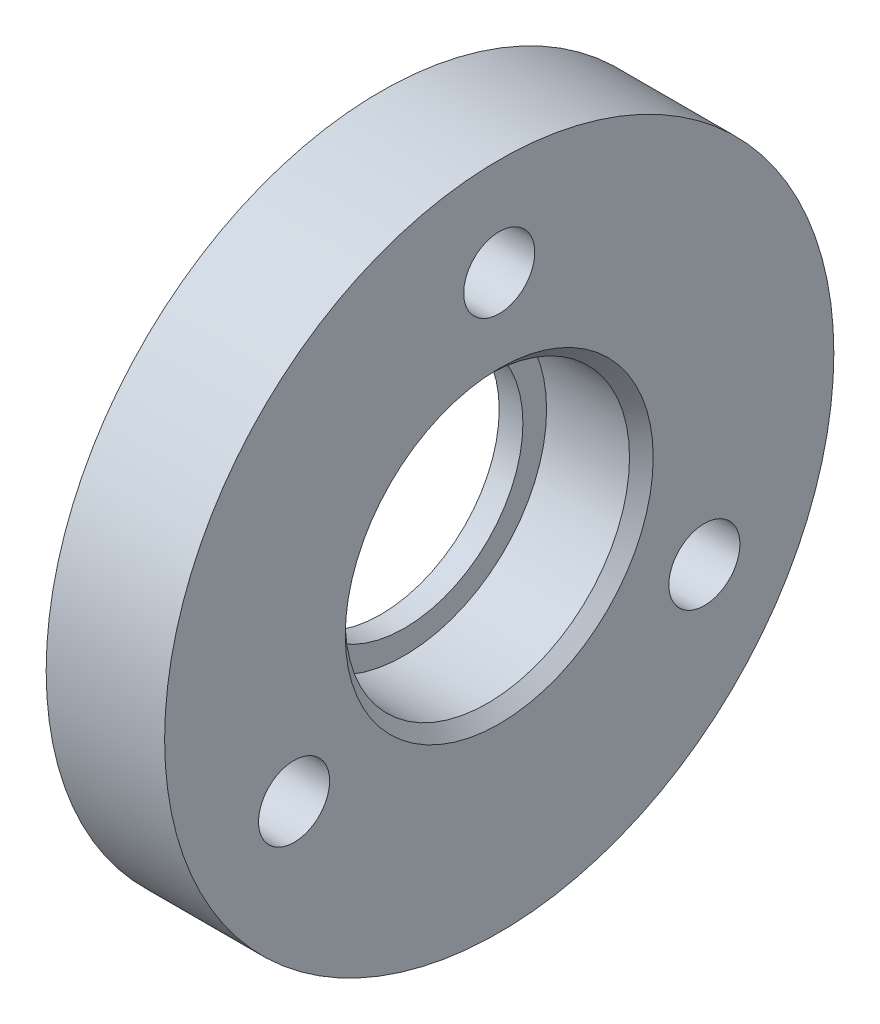
from build123d import *

# Parameters (mm, degrees)
SKETCH3_R           = 14.125
SKETCH3_R_2         = 6
BOSS_EXTRUDE1_DEPTH = 5
BOSS_EXTRUDE2_START = -5
SKETCH4_R           = 6
SKETCH4_R_2         = 5
BOSS_EXTRUDE2_DEPTH = 1
SKETCH5_R           = 1.5
CUT_EXTRUDE1_DEPTH  = 10
CHAMFER1_SIZE       = 0.5


with BuildPart() as part:
    # Sketch3 → Boss-Extrude1 (new body)
    with BuildSketch(Plane.YZ):
        with Locations(Location((0, 0, 0), (0, 0, 270))):
            Circle(SKETCH3_R)
        with Locations(Location((0, 0, 0), (0, 0, 270))):
            Circle(SKETCH3_R_2, mode=Mode.SUBTRACT)
    extrude(amount=BOSS_EXTRUDE1_DEPTH)

    # Sketch4 → Boss-Extrude2 (add)
    with BuildSketch(Plane.YZ.offset(5).offset(BOSS_EXTRUDE2_START)):
        with Locations(Location((0, 0, 0), (0, 0, 270))):
            Circle(SKETCH4_R)
        with Locations(Location((0, 0, 0), (0, 0, 270))):
            Circle(SKETCH4_R_2, mode=Mode.SUBTRACT)
    extrude(amount=BOSS_EXTRUDE2_DEPTH)

    # Sketch5 → Cut-Extrude1 (cut)
    with BuildSketch(Plane(origin=(5, 0, 0), x_dir=(0, 0, -1), z_dir=(1, 0, 0))):
        with Locations((0, 10)):
            Circle(SKETCH5_R)
        with Locations((8.660254038, -5)):
            Circle(SKETCH5_R)
        with Locations((-8.660254038, -5)):
            Circle(SKETCH5_R)
    extrude(amount=-CUT_EXTRUDE1_DEPTH, mode=Mode.SUBTRACT)

    # Chamfer1
    chamfer1_edges = [part.edges().sort_by_distance(p)[0] for p in [
        (5, 0, 6),
    ]]
    chamfer(chamfer1_edges, length=CHAMFER1_SIZE)


solid = part.part
